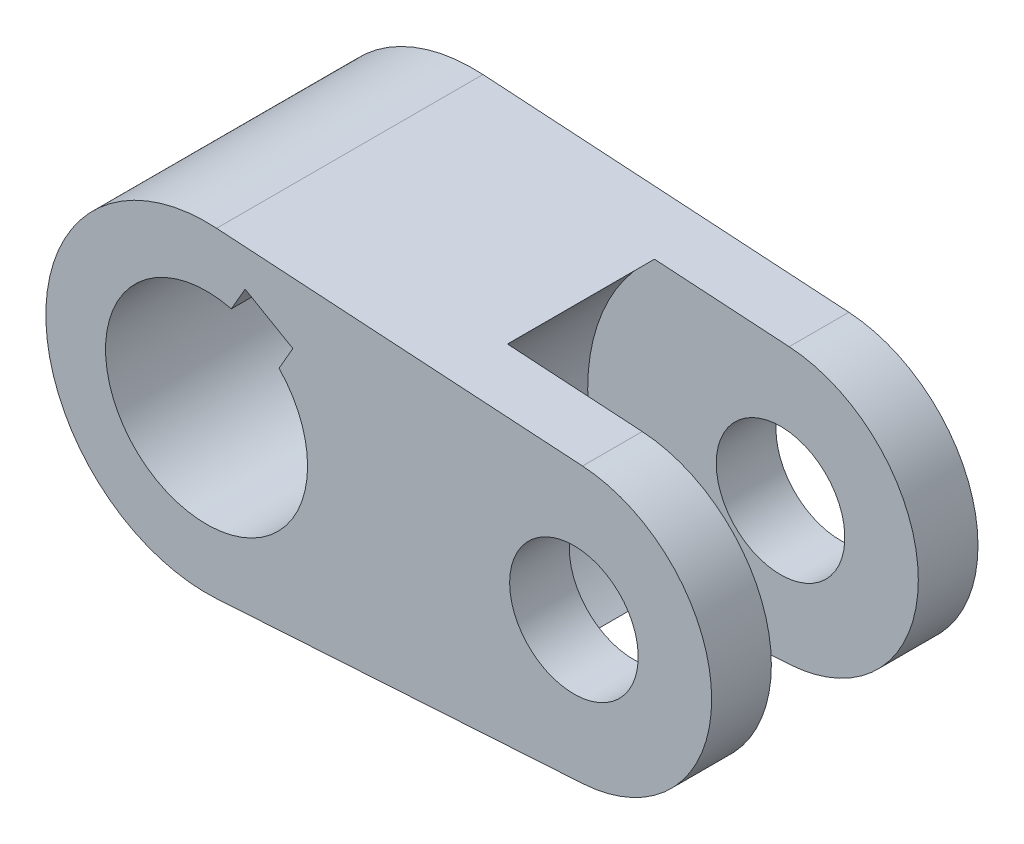
from build123d import *

# Parameters (mm, degrees)
SKETCH_1_R          = 7
EXTRUDE_1_DEPTH     = 14.5
SKETCH_2_R          = 21
CUT_EXTRUDE_1_DEPTH = 8


with BuildPart() as part:
    # Эскиз1 → Бобышка-Вытянуть1 (new, symmetric)
    with BuildSketch(Plane.XY):
        with BuildLine():
            Line((40.9375, 14.970674459), (1.09375, 17.465786869))
            ThreePointArc((1.09375, 17.465786869), (-17.5, 0), (1.09375, -17.465786869))
            Line((1.09375, -17.465786869), (40.9375, -14.970674459))
            ThreePointArc((40.9375, -14.970674459), (55, 0), (40.9375, 14.970674459))
        make_face()
        with Locations(Location((40, 0, 0), (0, 0, 180))):
            Circle(SKETCH_1_R, mode=Mode.SUBTRACT)
        with BuildLine():
            Line((2.693426411, 10.66515139), (4.201923789, 13.277945491))
            Line((4.201923789, 13.277945491), (9.398076211, 10.277945491))
            Line((9.398076211, 10.277945491), (7.889578833, 7.66515139))
            ThreePointArc((7.889578833, 7.66515139), (-5.5, -9.526279442), (2.693426411, 10.66515139))
        make_face(mode=Mode.SUBTRACT)
    extrude(amount=EXTRUDE_1_DEPTH, both=True)

    # Эскиз2 → Вырез-Вытянуть1 (cut, symmetric)
    with BuildSketch(Plane.XY):
        with Locations((40, 0)):
            Circle(SKETCH_2_R)
    extrude(amount=CUT_EXTRUDE_1_DEPTH, both=True, mode=Mode.SUBTRACT)


solid = part.part
